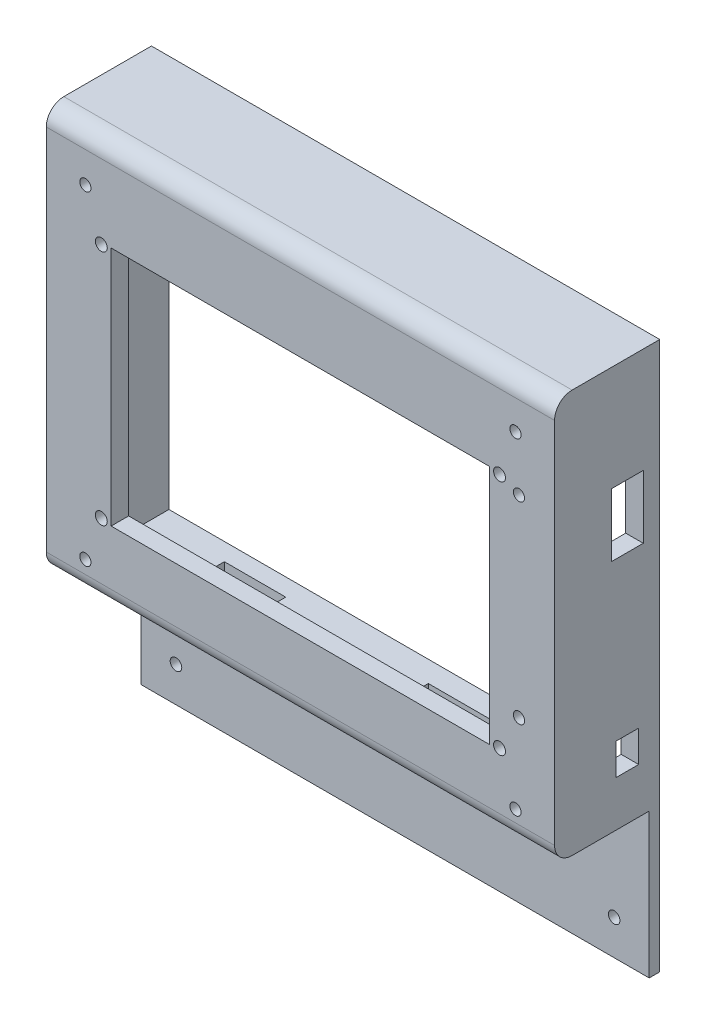
from build123d import *

# Parameters (mm, degrees)
SKETCH_1_W           = 145
SKETCH_1_H           = 120
SKETCH_1_R           = 1.6
EXTRUDE_1_DEPTH      = 5
SKETCH_2_W           = 145
SKETCH_2_H           = 5
CUT_EXTRUDE_1_DEPTH  = 8
SKETCH_3_W           = 145
SKETCH_3_H           = 115
SKETCH_3_W_2         = 135
SKETCH_3_H_2         = 107
EXTRUDE_6_DEPTH      = 30
SKETCH_4_W           = 145
SKETCH_4_H           = 3
EXTRUDE_7_DEPTH      = 41.25
SKETCH_7_W           = 9
SKETCH_7_H           = 18
CUT_EXTRUDE_4_DEPTH  = 7
SKETCH_8_W           = 30
SKETCH_8_H           = 6
CUT_EXTRUDE_6_DEPTH  = 6
SKETCH_9_W           = 6.5
SKETCH_9_H           = 9
CUT_EXTRUDE_7_DEPTH  = 6
SKETCH_6_W           = 17.5
SKETCH_6_H           = 17
CUT_EXTRUDE_8_DEPTH  = 10
SKETCH_11_R          = 1.7
SKETCH_11_W          = 108
SKETCH_11_H          = 68.7
CUT_EXTRUDE_9_DEPTH  = 5
FILLET_1_R           = 5
FILLET_2_R           = 5
SKETCH_13_R          = 1.65
CUT_EXTRUDE_10_DEPTH = 8


with BuildPart() as part:
    # 草图1 → 凸台-拉伸1 (new body)
    with BuildSketch(Plane.XY):
        Rectangle(SKETCH_1_W, SKETCH_1_H)
        with Locations((-49.95, -23.5)):
            Circle(SKETCH_1_R, mode=Mode.SUBTRACT)
        with Locations((-49.95, 31.5)):
            Circle(SKETCH_1_R, mode=Mode.SUBTRACT)
        with Locations((-61.35, 46.25)):
            Circle(SKETCH_1_R, mode=Mode.SUBTRACT)
        with Locations((61.35, -46.6)):
            Circle(SKETCH_1_R, mode=Mode.SUBTRACT)
        with Locations((61.35, 46.6)):
            Circle(SKETCH_1_R, mode=Mode.SUBTRACT)
        with Locations((-61.35, -46.25)):
            Circle(SKETCH_1_R, mode=Mode.SUBTRACT)
        with Locations((62.35, 31.5)):
            Circle(SKETCH_1_R, mode=Mode.SUBTRACT)
        with Locations((62.35, -23.5)):
            Circle(SKETCH_1_R, mode=Mode.SUBTRACT)
    extrude(amount=EXTRUDE_1_DEPTH)

    # 草图2 → 切除-拉伸1 (cut)
    with BuildSketch(Plane.XY.offset(5)):
        with Locations((0, -57.5)):
            Rectangle(SKETCH_2_W, SKETCH_2_H)
    extrude(amount=-CUT_EXTRUDE_1_DEPTH, mode=Mode.SUBTRACT)

    # 草图3 → 凸台-拉伸6 (add)
    with BuildSketch(Plane.XY.offset(5)):
        with Locations((0, 2.5)):
            Rectangle(SKETCH_3_W, SKETCH_3_H)
        with Locations((0, 1.5)):
            Rectangle(SKETCH_3_W_2, SKETCH_3_H_2, mode=Mode.SUBTRACT)
    extrude(amount=-EXTRUDE_6_DEPTH)

    # 草图4 → 凸台-拉伸7 (add)
    with BuildSketch(Plane(origin=(0, -55, 0), x_dir=(-1, 0, 0), z_dir=(0, -1, 0))):
        with Locations((0, 23.5)):
            Rectangle(SKETCH_4_W, SKETCH_4_H)
    extrude(amount=EXTRUDE_7_DEPTH)

    # 草图7 → 切除-拉伸4 (cut)
    with BuildSketch(Plane(origin=(72.5, 0, 0), x_dir=(0, 0, -1), z_dir=(1, 0, 0))):
        with Locations((15.8, 21)):
            Rectangle(SKETCH_7_W, SKETCH_7_H)
    extrude(amount=-CUT_EXTRUDE_4_DEPTH, mode=Mode.SUBTRACT)

    # 草图8 → 切除-拉伸6 (cut)
    with BuildSketch(Plane.XZ.offset(55)):
        with Locations((27.5, -16)):
            Rectangle(SKETCH_8_W, SKETCH_8_H)
    extrude(amount=-CUT_EXTRUDE_6_DEPTH, mode=Mode.SUBTRACT)

    # 草图9 → 切除-拉伸7 (cut)
    with BuildSketch(Plane(origin=(72.5, 0, 0), x_dir=(0, 0, -1), z_dir=(1, 0, 0))):
        with Locations((15.75, -37.5)):
            Rectangle(SKETCH_9_W, SKETCH_9_H)
    extrude(amount=-CUT_EXTRUDE_7_DEPTH, mode=Mode.SUBTRACT)

    # 草图6 → 切除-拉伸8 (cut)
    with BuildSketch(Plane.XZ.offset(55)):
        with Locations((-37.94, -11.5)):
            Rectangle(SKETCH_6_W, SKETCH_6_H)
    extrude(amount=-CUT_EXTRUDE_8_DEPTH, mode=Mode.SUBTRACT)

    # 草图11 → 切除-拉伸9 (cut)
    with BuildSketch(Plane.XY.offset(5)):
        with Locations((56.8, 33.8)):
            Circle(SKETCH_11_R)
        with Locations(Location((56.8, -33.8, 0), (0, 0, 180))):
            Circle(SKETCH_11_R)
        with Locations((-56.8, -33.8)):
            Circle(SKETCH_11_R)
        with Locations(Location((-56.8, 33.8, 0), (0, 0, 180))):
            Circle(SKETCH_11_R)
        Rectangle(SKETCH_11_W, SKETCH_11_H)
    extrude(amount=-CUT_EXTRUDE_9_DEPTH, mode=Mode.SUBTRACT)

    # 圆角1
    fillet_1_edges = [part.edges().sort_by_distance(p)[0] for p in [
        (0, -55, 5),
    ]]
    fillet(fillet_1_edges, radius=FILLET_1_R)

    # 圆角2
    fillet_2_edges = [part.edges().sort_by_distance(p)[0] for p in [
        (0, 60, 5),
    ]]
    fillet(fillet_2_edges, radius=FILLET_2_R)

    # 草图13 → 切除-拉伸10 (cut)
    with BuildSketch(Plane.XY.offset(-22)):
        with Locations((-62.5, -86.25)):
            Circle(SKETCH_13_R)
        with Locations((62.5, -86.25)):
            Circle(SKETCH_13_R)
    extrude(amount=-CUT_EXTRUDE_10_DEPTH, mode=Mode.SUBTRACT)


solid = part.part
